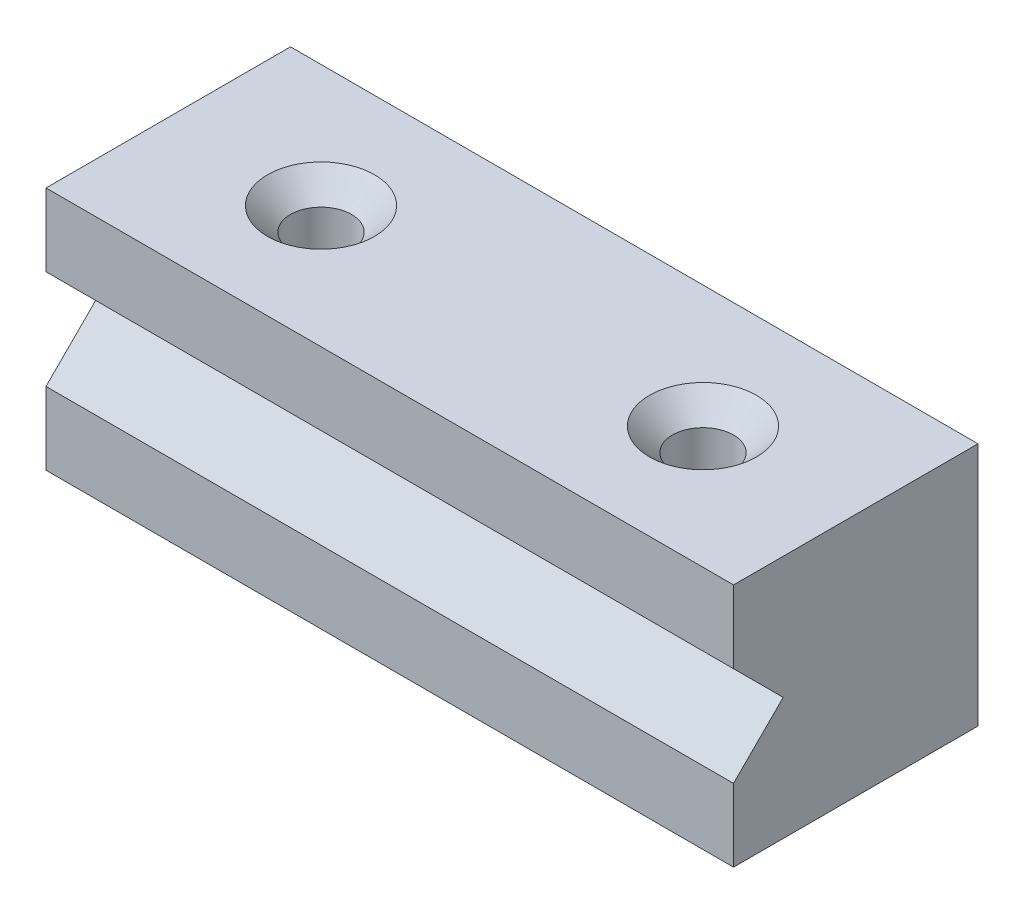
from build123d import *

# Parameters (mm, degrees)
BOSS_EXTRUDE1_DEPTH   = 45
F_1_0MM_DOWEL_HOLE1_D = 8
CHAMFER1_SIZE         = 3


with BuildPart() as part:
    # Sketch1 → Boss-Extrude1 (new, symmetric)
    with BuildSketch(Plane(origin=(0, 0, 0), x_dir=(0, 0, -1), z_dir=(1, 0, 0))):
        Polygon((-16, 16), (-16, 6.5), (-9.5, 0), (-16, -6.5), (-16, -16), (16, -16), (16, 16), align=None)
    extrude(amount=BOSS_EXTRUDE1_DEPTH, both=True)

    # Ø1.0mm Dowel Hole1 (through all)
    with Locations(Plane(origin=(0, 16, 0), x_dir=(1, 0, 0), z_dir=(0, 1, 0))):
        with Locations((25, 0), (-25, 0)):
            Hole(F_1_0MM_DOWEL_HOLE1_D / 2)

    # Chamfer1
    chamfer1_edges = [part.edges().sort_by_distance(p)[0] for p in [
        (-21, 16, 0),
        (29, 16, 0),
    ]]
    chamfer(chamfer1_edges, length=CHAMFER1_SIZE)


solid = part.part
